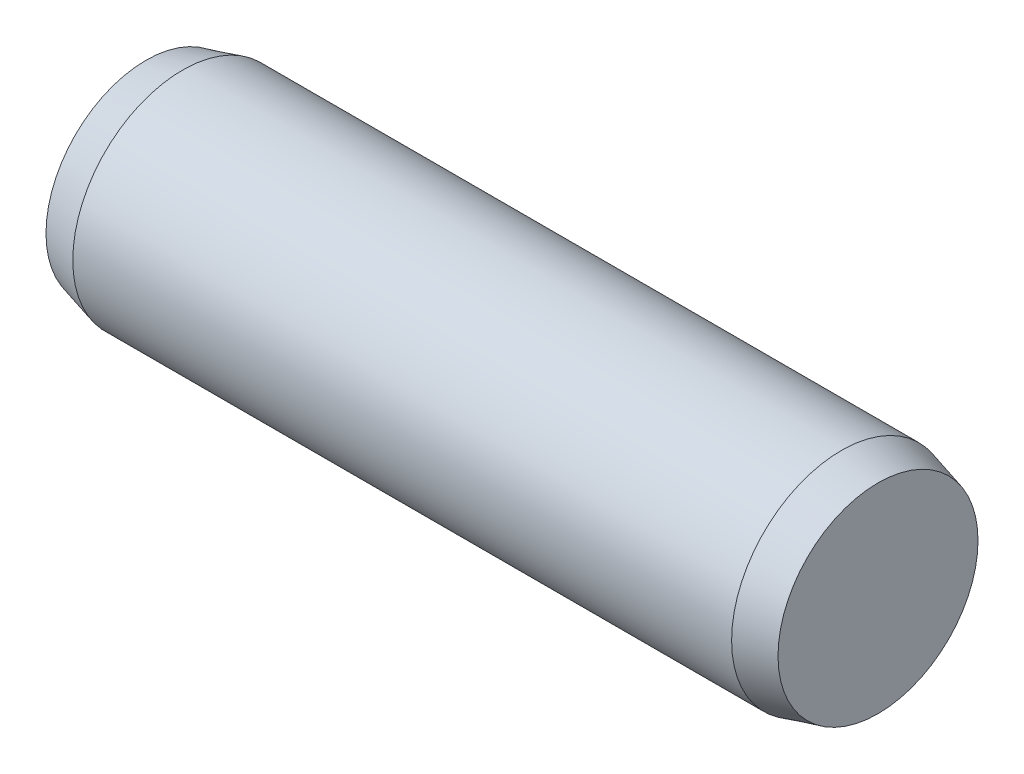
from build123d import *


with BuildPart() as part:
    # Sketch1 → Base-Revolve (revolve)
    with BuildSketch(Plane.XY, mode=Mode.PRIVATE) as base_revolve_sk:
        Polygon((0, 0), (10, 0), (10, 1.366025404), (9.5, 1.5), (0.5, 1.5), (0, 1.366025404), align=None)
    revolve(base_revolve_sk.sketch.rotate(Axis((-6.35, 0, 0), (1, 0, 0)), 90), axis=Axis((-6.35, 0, 0), (1, 0, 0)))


solid = part.part
